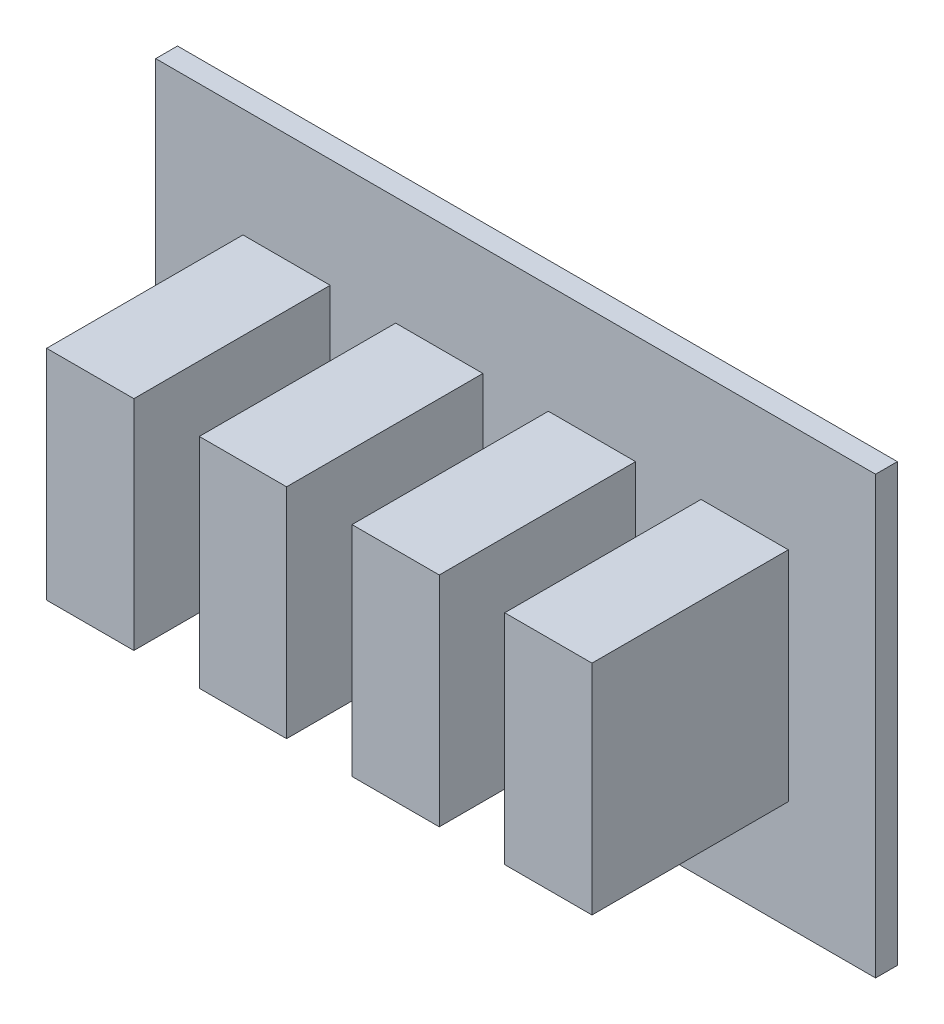
from build123d import *

# Parameters (mm, degrees)
ESQUISSE2_W        = 3.3
ESQUISSE2_H        = 2
BOSS_EXTRU_1_DEPTH = 0.1
ESQUISSE3_W        = 0.4
ESQUISSE3_H        = 1
BOSS_EXTRU_2_DEPTH = 0.9


with BuildPart() as part:
    # Esquisse2 → Boss.-Extru.1 (new body)
    with BuildSketch(Plane.XY):
        with Locations((1.65, 1)):
            Rectangle(ESQUISSE2_W, ESQUISSE2_H)
    extrude(amount=BOSS_EXTRU_1_DEPTH)

    # Esquisse3 → Boss.-Extru.2 (add)
    with BuildSketch(Plane.XY.offset(0.1)):
        with Locations((0.6, 1)):
            Rectangle(ESQUISSE3_W, ESQUISSE3_H)
        with Locations((1.3, 1)):
            Rectangle(ESQUISSE3_W, ESQUISSE3_H)
        with Locations((2, 1)):
            Rectangle(ESQUISSE3_W, ESQUISSE3_H)
        with Locations((2.7, 1)):
            Rectangle(ESQUISSE3_W, ESQUISSE3_H)
    extrude(amount=BOSS_EXTRU_2_DEPTH)


solid = part.part
